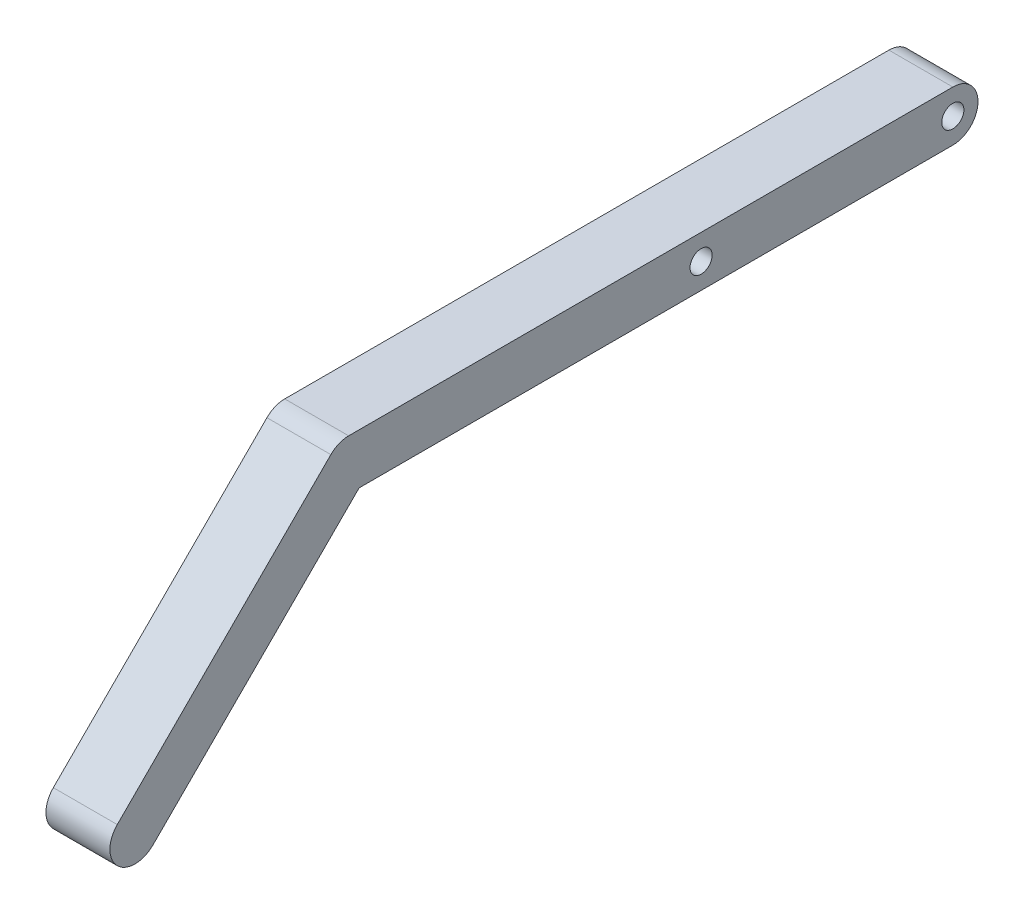
from build123d import *

# Parameters (mm, degrees)
SKETCH2_R           = 2.2
BOSS_EXTRUDE1_DEPTH = 12.7


with BuildPart() as part:
    # Sketch2 → Boss-Extrude1 (new body)
    with BuildSketch(Plane(origin=(0, 0, 0), x_dir=(0, 0, -1), z_dir=(1, 0, 0))):
        with BuildLine():
            Line((-75, 155), (45, 155))
            ThreePointArc((45, 155), (50, 150), (45, 145))
            Line((45, 145), (-72.928932188, 145))
            Line((-72.928932188, 145), (-113.890872965, 104.038059223))
            ThreePointArc((-113.890872965, 104.038059223), (-120.961940777, 104.038059223), (-120.961940777, 111.109127035))
            Line((-120.961940777, 111.109127035), (-78.535533906, 153.535533906))
            ThreePointArc((-78.535533906, 153.535533906), (-76.913417162, 154.619397663), (-75, 155))
        make_face()
        with Locations((-5, 150)):
            Circle(SKETCH2_R, mode=Mode.SUBTRACT)
        with Locations((45, 150)):
            Circle(SKETCH2_R, mode=Mode.SUBTRACT)
    extrude(amount=BOSS_EXTRUDE1_DEPTH)


solid = part.part
